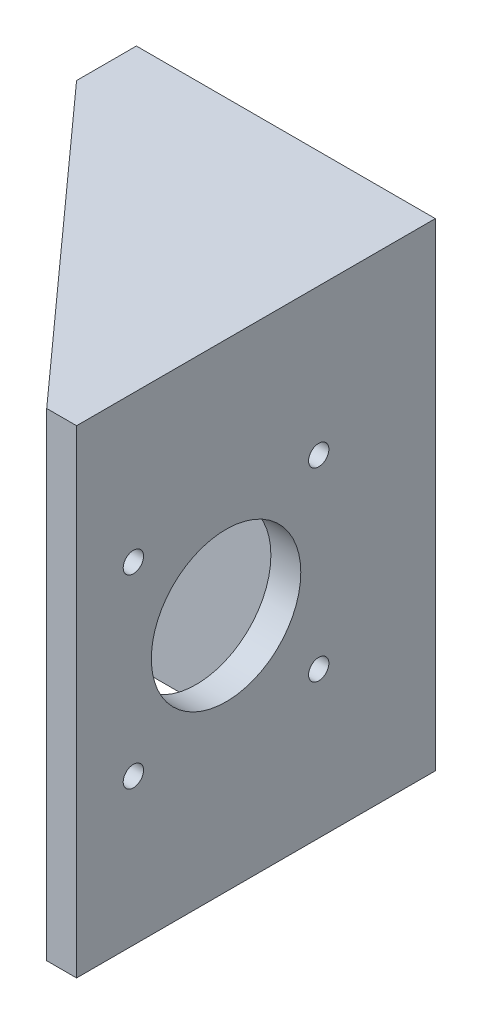
from build123d import *

# Parameters (mm, degrees)
SKETCH1_W                      = 50
SKETCH1_H                      = 80
BOSS_EXTRUDE1_DEPTH            = 10
SKETCH2_W                      = 5
SKETCH2_H                      = 80
BOSS_EXTRUDE2_DEPTH            = 50
SKETCH3_R                      = 12.5
CUT_EXTRUDE1_DEPTH             = 88.749643874
M3_CLEARANCE_HOLE1_D           = 3.4
CBORE_FOR_M5_SHCS1_D           = 5.5
CBORE_FOR_M5_SHCS1_CBORE_D     = 10
CBORE_FOR_M5_SHCS1_CBORE_DEPTH = 5
FILLET11_R                     = 2
BOSS_EXTRUDE3_DEPTH            = 6.35


with BuildPart() as part:
    # Sketch1 → Boss-Extrude1 (new body)
    with BuildSketch(Plane.XY):
        Rectangle(SKETCH1_W, SKETCH1_H)
    extrude(amount=BOSS_EXTRUDE1_DEPTH)

    # Sketch2 → Boss-Extrude2 (add)
    with BuildSketch(Plane.XY.offset(10)):
        with Locations((22.5, 0)):
            Rectangle(SKETCH2_W, SKETCH2_H)
    extrude(amount=BOSS_EXTRUDE2_DEPTH)

    # Sketch3 → Cut-Extrude1 (cut, through all)
    with BuildSketch(Plane(origin=(25, 0, 0), x_dir=(0, 0, -1), z_dir=(1, 0, 0))):
        with Locations((-35, 0)):
            Circle(SKETCH3_R)
    extrude(amount=-CUT_EXTRUDE1_DEPTH, mode=Mode.SUBTRACT)

    # M3 Clearance Hole1 (through all)
    with Locations(Plane(origin=(25, 0, 0), x_dir=(0, 0, -1), z_dir=(1, 0, 0))):
        with Locations((-50.5, -15.5), (-35, 0), (-50.5, 15.5), (-19.5, -15.5), (-19.5, 15.5)):
            Hole(M3_CLEARANCE_HOLE1_D / 2)

    # CBORE for M5 SHCS1 (through all)
    with Locations(Plane.XY.offset(10)):
        with Locations((-15.902931391, 24.76), (10.902931391, 24.76), (-15.902931391, -24.76), (10.902931391, -24.76)):
            CounterBoreHole(CBORE_FOR_M5_SHCS1_D / 2, CBORE_FOR_M5_SHCS1_CBORE_D / 2, CBORE_FOR_M5_SHCS1_CBORE_DEPTH)

    # Fillet11
    fillet11_edges = [part.edges().sort_by_distance(p)[0] for p in [
        (20, 0, 10),
    ]]
    fillet(fillet11_edges, radius=FILLET11_R)

    # Sketch8 → Boss-Extrude3 (add)
    with BuildSketch(Plane(origin=(0, 40, 0), x_dir=(1, 0, 0), z_dir=(0, 1, 0))):
        Polygon((-25, -10), (20, -60), (20, -10), align=None)
    extrude(amount=-BOSS_EXTRUDE3_DEPTH)


solid = part.part
